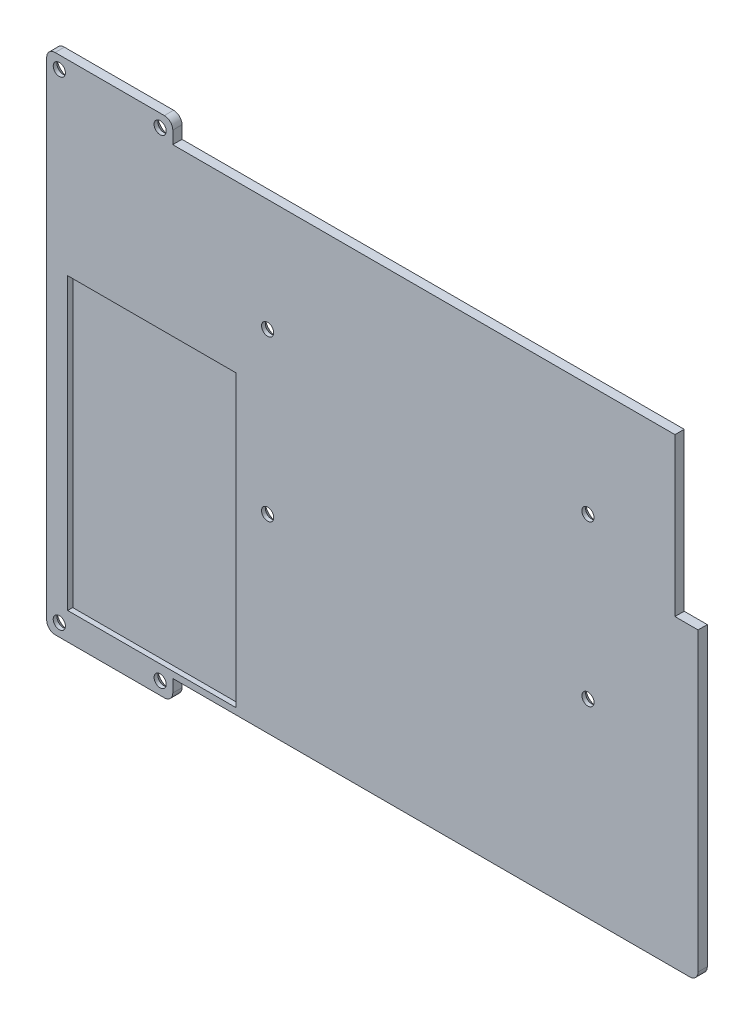
from build123d import *

# Parameters (mm, degrees)
BOSS_EXTRUDE1_DEPTH                            = 2.2
CSK_FOR_M2_5_COUNTERSUNK_FLAT_HEAD_S_2_COUNT   = 2
CSK_FOR_M2_5_COUNTERSUNK_FLAT_HEAD_S_2_PITCH   = 76.225
CSK_FOR_M2_5_COUNTERSUNK_FLAT_HEAD_S_3_COUNT   = 2
CSK_FOR_M2_5_COUNTERSUNK_FLAT_HEAD_S_3_PITCH   = 85.216551356
CSK_FOR_M2_5_COUNTERSUNK_FLAT_HEAD_S_4_COUNT   = 2
CSK_FOR_M2_5_COUNTERSUNK_FLAT_HEAD_S_4_PITCH   = 38.1
CSK_FOR_M2_5_COUNTERSUNK_FLAT_HEAD_S_5_A_COUNT = 2
CSK_FOR_M2_5_COUNTERSUNK_FLAT_HEAD_S_5_A_PITCH = 24
CSK_FOR_M2_5_COUNTERSUNK_FLAT_HEAD_S_6_COUNT   = 2
CSK_FOR_M2_5_COUNTERSUNK_FLAT_HEAD_S_6_PITCH   = 114
CSK_FOR_M2_5_COUNTERSUNK_FLAT_HEAD_S_7_COUNT   = 2
CSK_FOR_M2_5_COUNTERSUNK_FLAT_HEAD_S_7_PITCH   = 116.498927034
CUT_EXTRUDE1_DEPTH                             = 167.222260844
CUT_EXTRUDE1_DEPTH_BACK                        = 1.2
SKETCH4_W                                      = 40
SKETCH4_H                                      = 69


with BuildPart() as part:
    # Sketch1 → Boss-Extrude1 (new body)
    with BuildSketch(Plane.XY):
        with BuildLine():
            Line((2, -60), (28, -60))
            ThreePointArc((28, -60), (29.414213562, -59.414213562), (30, -58))
            Line((30, -58), (30, -55))
            Line((30, -55), (153, -55))
            ThreePointArc((153, -55), (154.414213562, -54.414213562), (155, -53))
            Line((155, -53), (155, 17.5))
            Line((155, 17.5), (149.5, 17.5))
            Line((149.5, 17.5), (149.5, 55))
            Line((149.5, 55), (30, 55))
            Line((30, 55), (30, 58))
            ThreePointArc((30, 58), (29.414213562, 59.414213562), (28, 60))
            Line((28, 60), (2, 60))
            ThreePointArc((2, 60), (0.585786438, 59.414213562), (0, 58))
            Line((0, 58), (0, -58))
            ThreePointArc((0, -58), (0.585786438, -59.414213562), (2, -60))
        make_face()
    extrude(amount=BOSS_EXTRUDE1_DEPTH)

    # Sketch2 → CSK for M2.5 Countersunk Flat Head Screw (revolve, cut)
    with BuildSketch(Plane(origin=(52.575, 28.25, 0), x_dir=(0, 1, 0), z_dir=(1, 0, 0))):
        Polygon((0, 0), (0, 2.2), (1.45, 2.2), (1.45, 1.3), (2.75, 0), align=None)
    csk_for_m2_5_countersunk_flat_head_screw = revolve(axis=Axis((52.575, 28.25, -6.35), (0, 0, 1)), mode=Mode.SUBTRACT)

    # CSK for M2.5 Countersunk Flat Head S 2: CSK for M2.5 Countersunk Flat Head Screw ×2
    with Locations(*[(i * CSK_FOR_M2_5_COUNTERSUNK_FLAT_HEAD_S_2_PITCH, 0, 0) for i in range(1, CSK_FOR_M2_5_COUNTERSUNK_FLAT_HEAD_S_2_COUNT)]):
        add(csk_for_m2_5_countersunk_flat_head_screw, mode=Mode.SUBTRACT)

    # CSK for M2.5 Countersunk Flat Head S 3: CSK for M2.5 Countersunk Flat Head Screw ×2
    with Locations(*[Vector(0.8944858573496409, -0.4470962435555436, 0) * (i * CSK_FOR_M2_5_COUNTERSUNK_FLAT_HEAD_S_3_PITCH) for i in range(1, CSK_FOR_M2_5_COUNTERSUNK_FLAT_HEAD_S_3_COUNT)]):
        add(csk_for_m2_5_countersunk_flat_head_screw, mode=Mode.SUBTRACT)

    # CSK for M2.5 Countersunk Flat Head S 4: CSK for M2.5 Countersunk Flat Head Screw ×2
    with Locations(*[(0, -i * CSK_FOR_M2_5_COUNTERSUNK_FLAT_HEAD_S_4_PITCH, 0) for i in range(1, CSK_FOR_M2_5_COUNTERSUNK_FLAT_HEAD_S_4_COUNT)]):
        add(csk_for_m2_5_countersunk_flat_head_screw, mode=Mode.SUBTRACT)

    # Sketch3 → CSK for M2.5 Countersunk Flat Head S 5 (revolve, cut)
    with BuildSketch(Plane(origin=(27, 57, 0), x_dir=(0, 1, 0), z_dir=(1, 0, 0))):
        Polygon((0, 0), (0, 2.2), (1.45, 2.2), (1.45, 1.3), (2.75, 0), align=None)
    csk_for_m2_5_countersunk_flat_head_s_5 = revolve(axis=Axis((27, 57, -6.35), (0, 0, 1)), mode=Mode.SUBTRACT)

    # CSK for M2.5 Countersunk Flat Head S 5 a: CSK for M2.5 Countersunk Flat Head S 5 ×2
    with Locations(*[(-i * CSK_FOR_M2_5_COUNTERSUNK_FLAT_HEAD_S_5_A_PITCH, 0, 0) for i in range(1, CSK_FOR_M2_5_COUNTERSUNK_FLAT_HEAD_S_5_A_COUNT)]):
        add(csk_for_m2_5_countersunk_flat_head_s_5, mode=Mode.SUBTRACT)

    # CSK for M2.5 Countersunk Flat Head S 6: CSK for M2.5 Countersunk Flat Head S 5 ×2
    with Locations(*[(0, -i * CSK_FOR_M2_5_COUNTERSUNK_FLAT_HEAD_S_6_PITCH, 0) for i in range(1, CSK_FOR_M2_5_COUNTERSUNK_FLAT_HEAD_S_6_COUNT)]):
        add(csk_for_m2_5_countersunk_flat_head_s_5, mode=Mode.SUBTRACT)

    # CSK for M2.5 Countersunk Flat Head S 7: CSK for M2.5 Countersunk Flat Head S 5 ×2
    with Locations(*[Vector(-0.206010481049842, -0.978549784986749, 0) * (i * CSK_FOR_M2_5_COUNTERSUNK_FLAT_HEAD_S_7_PITCH) for i in range(1, CSK_FOR_M2_5_COUNTERSUNK_FLAT_HEAD_S_7_COUNT)]):
        add(csk_for_m2_5_countersunk_flat_head_s_5, mode=Mode.SUBTRACT)

    # Sketch4 → Cut-Extrude1 (cut, two sides: drawn at the far end of the back side and taken through both)
    with BuildSketch(Plane.XY.offset(2.2).offset(-CUT_EXTRUDE1_DEPTH_BACK)):
        with Locations((25, -19)):
            Rectangle(SKETCH4_W, SKETCH4_H)
    extrude(amount=CUT_EXTRUDE1_DEPTH + CUT_EXTRUDE1_DEPTH_BACK, mode=Mode.SUBTRACT)


solid = part.part
